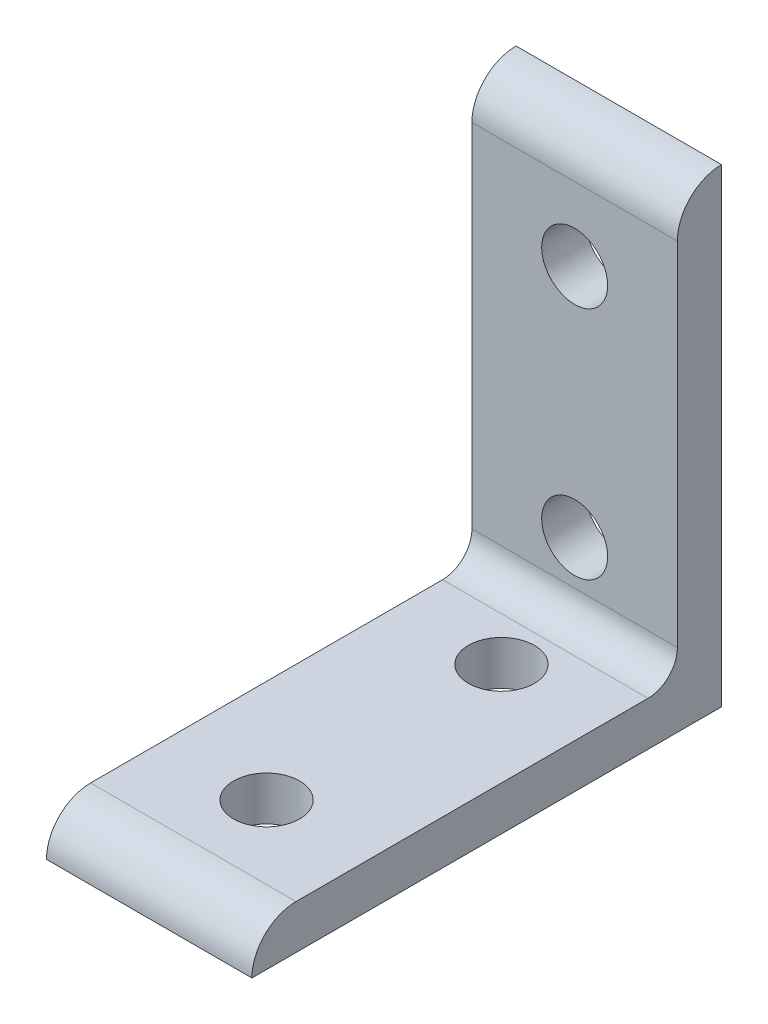
from build123d import *

# Parameters (mm, degrees)
BOSS_EXTRUDE1_DEPTH      = 22.225
K_0_281_DIAMETER_HOLE1_D = 7.1374
K_0_281_DIAMETER_HOLE2_D = 7.1374
FILLET1_R                = 3.175


with BuildPart() as part:
    # Sketch1 → Boss-Extrude1 (new body)
    with BuildSketch(Plane(origin=(22.225, 0, 0), x_dir=(0, 0, -1), z_dir=(1, 0, 0))):
        with BuildLine():
            Line((17.825636205, 67.922474698), (17.825636205, 26.672874698))
            Line((17.825636205, 26.672874698), (-23.423963795, 26.672874698))
            ThreePointArc((-23.423963795, 26.672874698), (-26.800540098, 25.274250999), (-28.199163797, 21.897674696))
            Line((-28.199163797, 21.897674696), (22.600836205, 21.897674696))
            Line((22.600836205, 21.897674696), (22.600836205, 72.697674698))
            ThreePointArc((22.600836205, 72.697674698), (19.224259904, 71.299051), (17.825636205, 67.922474698))
        make_face()
    extrude(amount=-BOSS_EXTRUDE1_DEPTH)

    # K (0.281) Diameter Hole1 (through all)
    with Locations(Plane(origin=(0, 0, -22.600836205), x_dir=(-1, 0, 0), z_dir=(0, 0, -1))):
        with Locations((-11.1125, 59.997674696), (-11.1125, 34.597674696)):
            Hole(K_0_281_DIAMETER_HOLE1_D / 2)

    # K (0.281) Diameter Hole2 (through all)
    with Locations(Plane(origin=(0, 26.672874698, 0), x_dir=(1, 0, 0), z_dir=(0, 1, 0))):
        with Locations((11.1125, 9.900836205), (11.1125, -15.499163795)):
            Hole(K_0_281_DIAMETER_HOLE2_D / 2)

    # Fillet1
    fillet1_edges = [part.edges().sort_by_distance(p)[0] for p in [
        (11.1125, 26.672874698, -17.825636205),
    ]]
    fillet(fillet1_edges, radius=FILLET1_R)


solid = part.part
